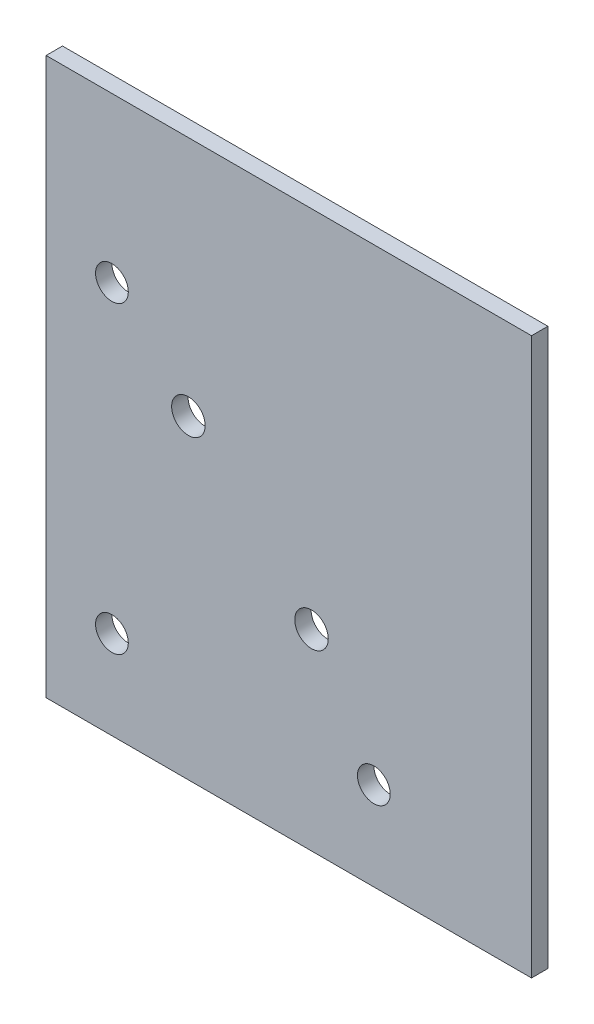
from build123d import *

# Parameters (mm, degrees)
SKETCH1_W           = 94.149921214
SKETCH1_H           = 107.889878539
SKETCH1_R           = 3.175
SKETCH1_R_2         = 3.2512
BOSS_EXTRUDE1_DEPTH = 3.175


with BuildPart() as part:
    # Sketch1 → Boss-Extrude1 (new body)
    with BuildSketch(Plane.XY):
        with Locations((-41.891689505, 154.705348562)):
            Rectangle(SKETCH1_W, SKETCH1_H)
        with Locations((-76.2, 117.928571429)):
            Circle(SKETCH1_R, mode=Mode.SUBTRACT)
        with Locations((-25.4, 117.928571429)):
            Circle(SKETCH1_R, mode=Mode.SUBTRACT)
        with Locations((-76.2, 176.892857143)):
            Circle(SKETCH1_R, mode=Mode.SUBTRACT)
        with Locations((-61.36746069, 161.872667498)):
            Circle(SKETCH1_R_2, mode=Mode.SUBTRACT)
        with Locations((-37.49146069, 137.996667498)):
            Circle(SKETCH1_R_2, mode=Mode.SUBTRACT)
    extrude(amount=BOSS_EXTRUDE1_DEPTH)


solid = part.part
